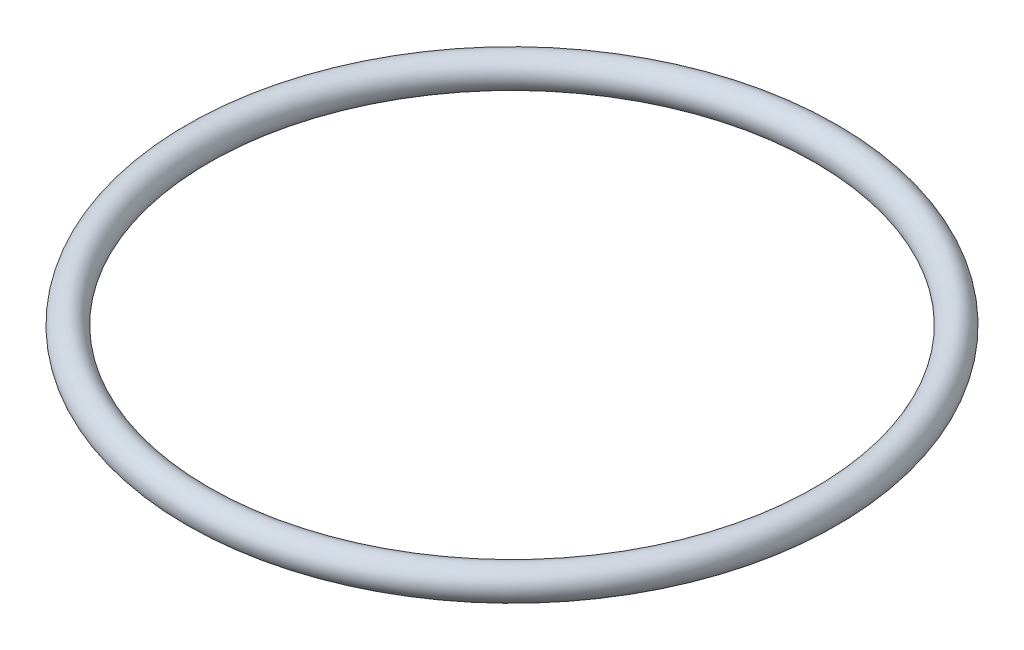
from build123d import *

# Parameters (mm, degrees)
SKETCH2_R = 1.3081


with BuildPart() as part:
    # Sweep1: sweep along a path in Sketch1
    with BuildLine(Plane(origin=(0, 0, 0), x_dir=(1, 0, 0), z_dir=(0, 1, 0))) as sweep1_path:
        CenterArc((0, 0), 25.2349, 0, 360)
    # Sketch2 → Sweep1 (sweep)
    with BuildSketch(Plane.XY):
        with Locations((-26.543, 0)):
            Circle(SKETCH2_R)
    sweep(path=sweep1_path.line)


solid = part.part
